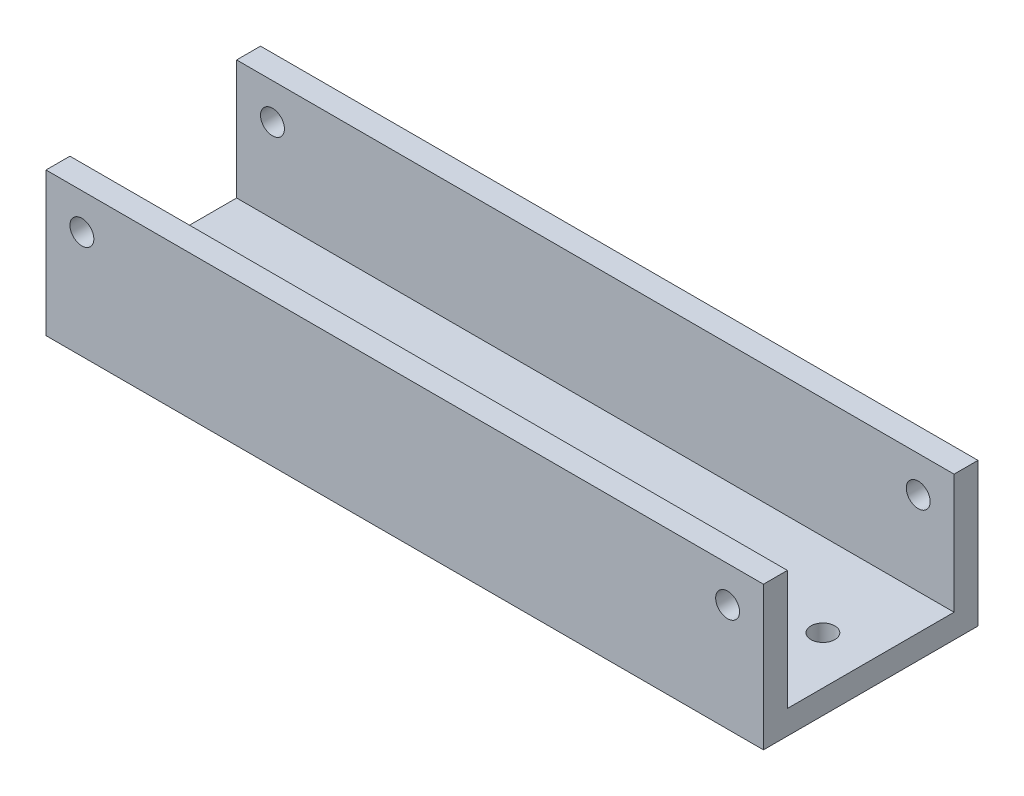
from build123d import *

# Parameters (mm, degrees)
SKETCH1_W           = 150
SKETCH1_H           = 40.85
BOSS_EXTRUDE1_DEPTH = 3
SKETCH2_W           = 150
SKETCH2_H           = 3
BOSS_EXTRUDE2_DEPTH = 25
BOSS_EXTRUDE3_DEPTH = 150
SKETCH6_R           = 2.5
CUT_EXTRUDE2_DEPTH  = 10
SKETCH7_R           = 2.5
CUT_EXTRUDE3_DEPTH  = 160.045661682


with BuildPart() as part:
    # Sketch1 → Boss-Extrude1 (new body)
    with BuildSketch(Plane(origin=(0, 0, 0), x_dir=(1, 0, 0), z_dir=(0, 1, 0))):
        with Locations((-75, 20.425)):
            Rectangle(SKETCH1_W, SKETCH1_H)
    extrude(amount=BOSS_EXTRUDE1_DEPTH)

    # Sketch2 → Boss-Extrude2 (add)
    with BuildSketch(Plane(origin=(0, 3, 0), x_dir=(1, 0, 0), z_dir=(0, 1, 0))):
        with Locations((-75, 39.35)):
            Rectangle(SKETCH2_W, SKETCH2_H)
        with Locations((-75, 1.5)):
            Rectangle(SKETCH2_W, SKETCH2_H)
    extrude(amount=BOSS_EXTRUDE2_DEPTH)

    # Sketch5 → Boss-Extrude3 (add)
    with BuildSketch(Plane(origin=(0, 0, 0), x_dir=(0, 0, -1), z_dir=(1, 0, 0))):
        Polygon((3, 28), (-2, 28), (-2, -2), (42.85, -2), (42.85, 28), (37.85, 28), (37.85, 3), (3, 3), align=None)
    extrude(amount=-BOSS_EXTRUDE3_DEPTH)

    # Sketch6 → Cut-Extrude2 (cut)
    with BuildSketch(Plane(origin=(0, 3, 0), x_dir=(1, 0, 0), z_dir=(0, 1, 0))):
        with Locations(Location((-140, 20.425, 0), (0, 0, 270))):
            Circle(SKETCH6_R)
        with Locations(Location((-10, 20.425, 0), (0, 0, 270))):
            Circle(SKETCH6_R)
    extrude(amount=-CUT_EXTRUDE2_DEPTH, mode=Mode.SUBTRACT)

    # Sketch7 → Cut-Extrude3 (cut, through all)
    with BuildSketch(Plane.XY.offset(2)):
        with Locations((-142.5, 20.5)):
            Circle(SKETCH7_R)
        with Locations((-7.5, 20.5)):
            Circle(SKETCH7_R)
    extrude(amount=-CUT_EXTRUDE3_DEPTH, mode=Mode.SUBTRACT)


solid = part.part
